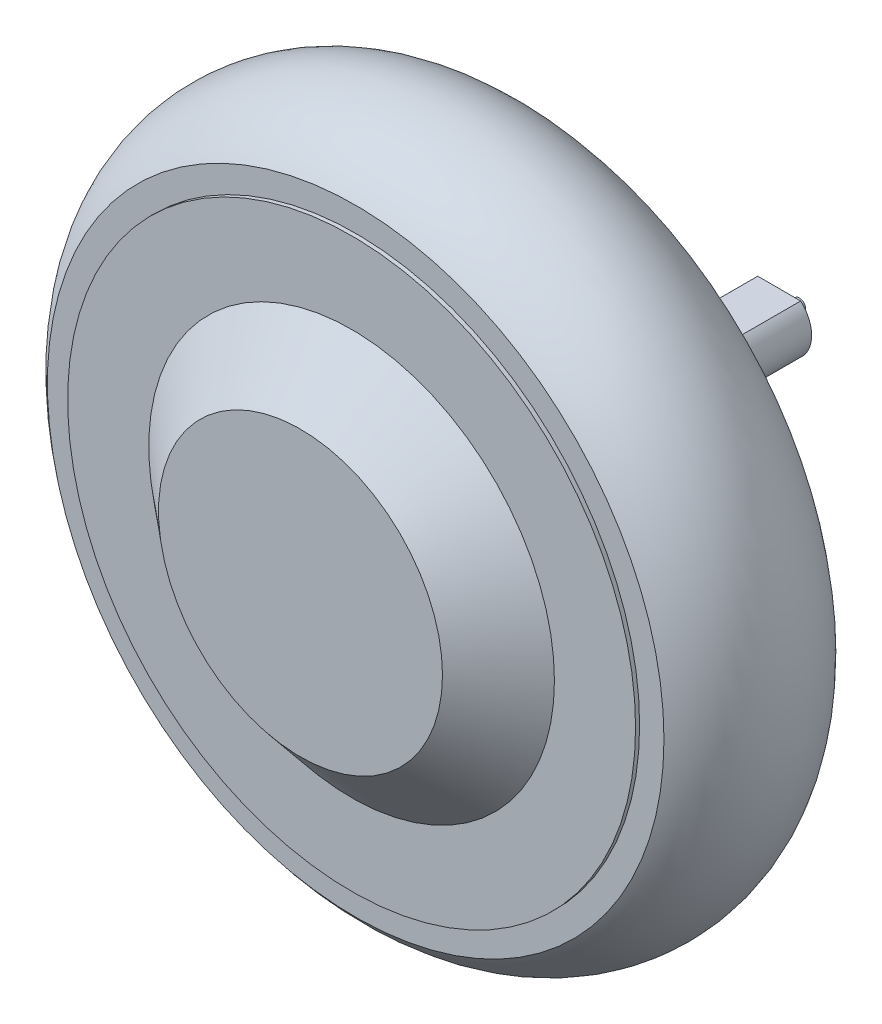
from build123d import *

# Parameters (mm, degrees)
CUT_EXTRUDE_1_DEPTH      = 170.966173207
CUT_EXTRUDE_1_DEPTH_BACK = 33


with BuildPart() as part:
    # 草图1 → 旋转1 (revolve)
    with BuildSketch(Plane(origin=(0, 0, 0), x_dir=(0, 0, -1), z_dir=(1, 0, 0)), mode=Mode.PRIVATE) as revolve_1_sk:
        with BuildLine():
            Line((-34.6, 0), (-34.6, 35))
            Line((-34.6, 35), (-22, 50))
            Line((-22, 50), (-22, 70))
            Line((-22, 70), (-21, 70))
            Line((-21, 70), (-21, 76))
            ThreePointArc((-21, 76), (0, 86.5), (21, 76))
            Line((21, 76), (21, 70))
            Line((21, 70), (22, 70))
            Line((22, 70), (22, 50))
            Line((22, 50), (34.6, 35))
            Line((34.6, 35), (34.6, 25))
            Line((34.6, 25), (40.4, 19.2))
            Line((40.4, 19.2), (40.4, 12))
            Line((40.4, 12), (45.4, 12))
            Line((45.4, 12), (45.4, 14))
            Line((45.4, 14), (48.4, 14))
            Line((48.4, 14), (48.4, 16))
            Line((48.4, 16), (50.4, 16))
            Line((50.4, 16), (50.4, 8))
            Line((50.4, 8), (83.4, 8))
            Line((83.4, 8), (83.4, 1.5))
            Line((83.4, 1.5), (88.4, 1.5))
            Line((88.4, 1.5), (88.4, 0))
            Line((88.4, 0), (-34.6, 0))
        make_face()
    revolve(revolve_1_sk.sketch.rotate(Axis((0, 0, 0), (0, 0, -1)), 90), axis=Axis((0, 0, 0), (0, 0, -1)))

    # 草图2 → 切除-拉伸1 (cut, two sides: drawn at the far end of the back side and taken through both)
    with BuildSketch(Plane(origin=(0, 0, -83.4), x_dir=(-1, 0, 0), z_dir=(0, 0, -1)).offset(-CUT_EXTRUDE_1_DEPTH_BACK)):
        with BuildLine():
            Line((-5.291502622, 6), (5.291502622, 6))
            ThreePointArc((5.291502622, 6), (0, 8), (-5.291502622, 6))
        make_face()
        with BuildLine():
            Line((-5.291502622, -6), (5.291502622, -6))
            ThreePointArc((5.291502622, -6), (0, -8), (-5.291502622, -6))
        make_face()
    extrude(amount=CUT_EXTRUDE_1_DEPTH + CUT_EXTRUDE_1_DEPTH_BACK, mode=Mode.SUBTRACT)


solid = part.part
